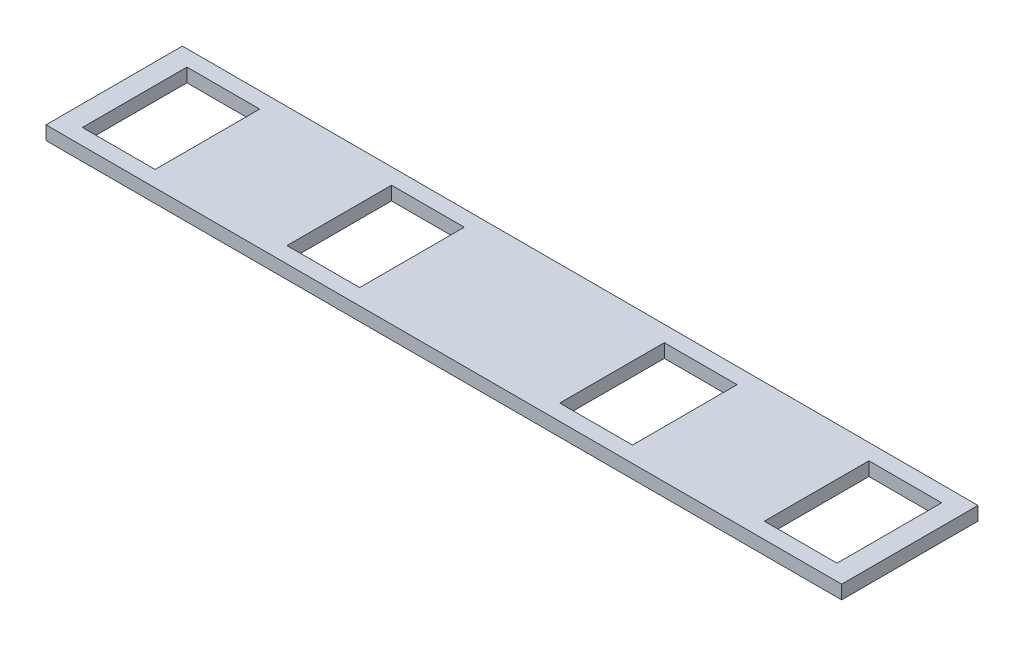
from build123d import *

# Parameters (mm, degrees)
CROQUIS1_W              = 175
CROQUIS1_H              = 30
CROQUIS1_W_2            = 16
CROQUIS1_H_2            = 23
SALIENTE_EXTRUIR1_DEPTH = 3


with BuildPart() as part:
    # Croquis1 → Saliente-Extruir1 (new body)
    with BuildSketch(Plane(origin=(0, 0, 0), x_dir=(1, 0, 0), z_dir=(0, 1, 0))):
        Rectangle(CROQUIS1_W, CROQUIS1_H)
        with Locations((-75, 0)):
            Rectangle(CROQUIS1_W_2, CROQUIS1_H_2, mode=Mode.SUBTRACT)
        with Locations((30, 0)):
            Rectangle(CROQUIS1_W_2, CROQUIS1_H_2, mode=Mode.SUBTRACT)
        with Locations((-30, 0)):
            Rectangle(CROQUIS1_W_2, CROQUIS1_H_2, mode=Mode.SUBTRACT)
        with Locations((75, 0)):
            Rectangle(CROQUIS1_W_2, CROQUIS1_H_2, mode=Mode.SUBTRACT)
    extrude(amount=SALIENTE_EXTRUIR1_DEPTH)


solid = part.part
